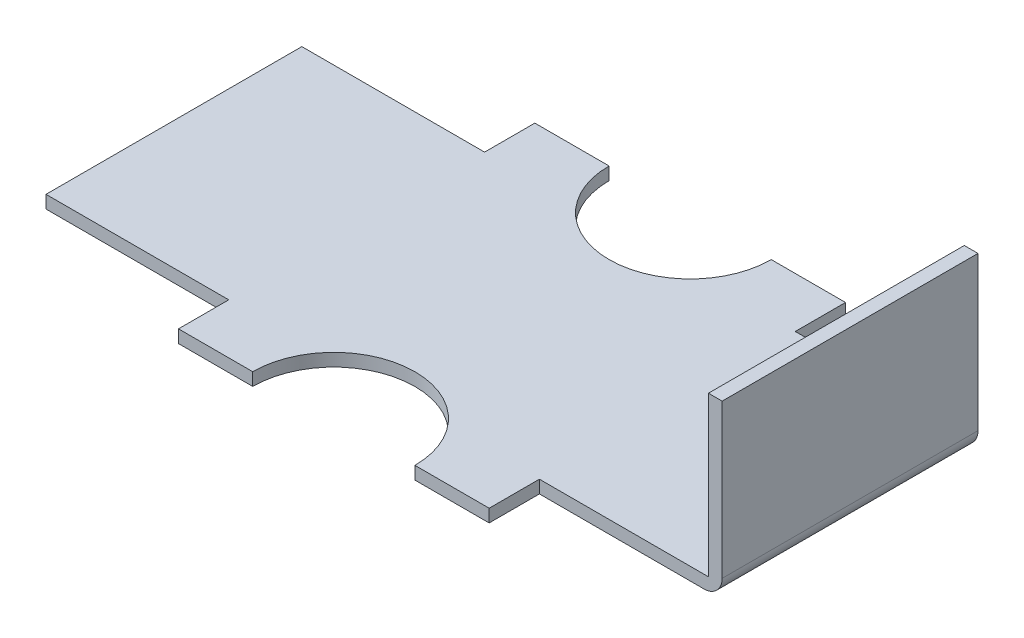
from build123d import *

# Parameters (mm, degrees)
SKETCH1_W           = 18.796
SKETCH1_H           = 9.906
BOSS_EXTRUDE1_DEPTH = 0.3556
SKETCH2_R           = 2.25425
SKETCH2_W           = 5.08
SKETCH2_H           = 1.397
CUT_EXTRUDE1_DEPTH  = 11.629255118
SKETCH3_W           = 0.381
SKETCH3_H           = 7.112
BOSS_EXTRUDE2_DEPTH = 4.4196
FILLET2_R           = 0.508


with BuildPart() as part:
    # Sketch1 → Boss-Extrude1 (new body)
    with BuildSketch(Plane(origin=(0, 0, 0), x_dir=(1, 0, 0), z_dir=(0, 1, 0))):
        Rectangle(SKETCH1_W, SKETCH1_H)
    extrude(amount=BOSS_EXTRUDE1_DEPTH)

    # Sketch2 → Cut-Extrude1 (cut, through all)
    with BuildSketch(Plane(origin=(0, 0.3556, 0), x_dir=(1, 0, 0), z_dir=(0, 1, 0))):
        with Locations((0, 4.953)):
            Circle(SKETCH2_R)
        with Locations((0, -4.953)):
            Circle(SKETCH2_R)
        with Locations((-6.858, 4.2545)):
            Rectangle(SKETCH2_W, SKETCH2_H)
        with Locations((6.858, -4.2545)):
            Rectangle(SKETCH2_W, SKETCH2_H)
        with Locations((6.858, 4.2545)):
            Rectangle(SKETCH2_W, SKETCH2_H)
        with Locations((-6.858, -4.2545)):
            Rectangle(SKETCH2_W, SKETCH2_H)
    extrude(amount=-CUT_EXTRUDE1_DEPTH, mode=Mode.SUBTRACT)

    # Sketch3 → Boss-Extrude2 (add)
    with BuildSketch(Plane(origin=(0, 0.3556, 0), x_dir=(1, 0, 0), z_dir=(0, 1, 0))):
        with Locations((9.2075, 0)):
            Rectangle(SKETCH3_W, SKETCH3_H)
    extrude(amount=BOSS_EXTRUDE2_DEPTH)

    # Fillet2
    fillet2_edges = [part.edges().sort_by_distance(p)[0] for p in [
        (9.398, 0, 0),
    ]]
    fillet(fillet2_edges, radius=FILLET2_R)


solid = part.part
